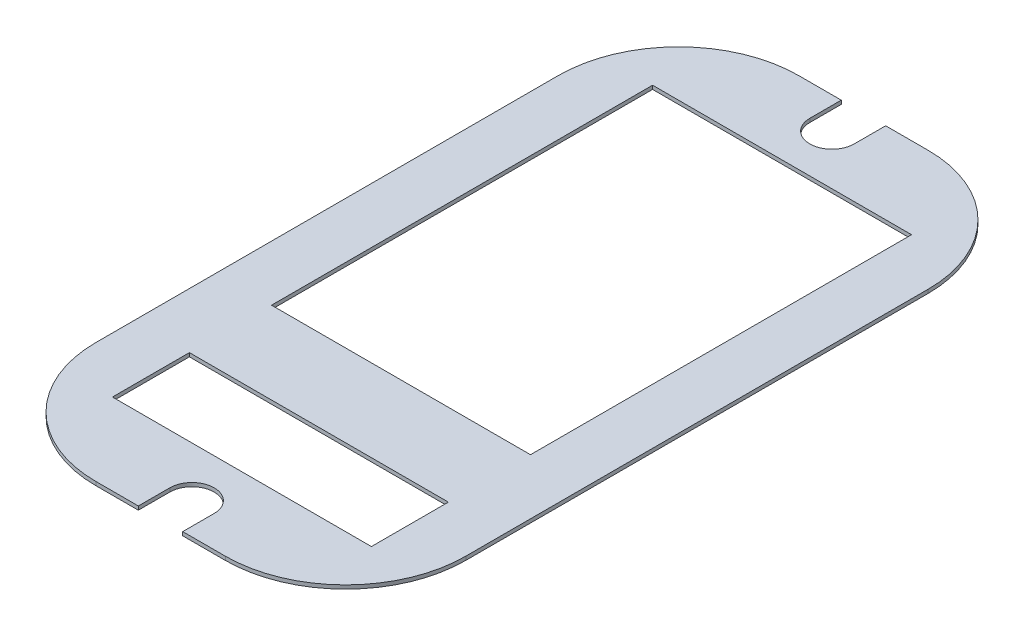
from build123d import *

# Parameters (mm, degrees)
SKETCH2_W           = 7
SKETCH2_H           = 10.3
SKETCH2_H_2         = 2.08
BOSS_EXTRUDE1_DEPTH = 0.1


with BuildPart() as part:
    # Sketch2 → Boss-Extrude1 (new body)
    with BuildSketch(Plane(origin=(0, 0, 0), x_dir=(1, 0, 0), z_dir=(0, 1, 0))):
        with BuildLine():
            Line((-0.6, 9.5), (-1.75, 9.5))
            ThreePointArc((-1.75, 9.5), (-4.048097039, 8.548097039), (-5, 6.25))
            Line((-5, 6.25), (-5, -6.25))
            ThreePointArc((-5, -6.25), (-4.048097039, -8.548097039), (-1.75, -9.5))
            Line((-1.75, -9.5), (-0.6, -9.5))
            Line((-0.6, -9.5), (-0.6, -8.65))
            ThreePointArc((-0.6, -8.65), (0, -8.05), (0.6, -8.65))
            Line((0.6, -8.65), (0.6, -9.5))
            Line((0.6, -9.5), (1.75, -9.5))
            ThreePointArc((1.75, -9.5), (4.048097039, -8.548097039), (5, -6.25))
            Line((5, -6.25), (5, 6.25))
            ThreePointArc((5, 6.25), (4.048097039, 8.548097039), (1.75, 9.5))
            Line((1.75, 9.5), (0.6, 9.5))
            Line((0.6, 9.5), (0.6, 8.65))
            ThreePointArc((0.6, 8.65), (0, 8.05), (-0.6, 8.65))
            Line((-0.6, 8.65), (-0.6, 9.5))
        make_face()
        with Locations((0, 2.15)):
            Rectangle(SKETCH2_W, SKETCH2_H, mode=Mode.SUBTRACT)
        with Locations((0, -6.26)):
            Rectangle(SKETCH2_W, SKETCH2_H_2, mode=Mode.SUBTRACT)
    extrude(amount=BOSS_EXTRUDE1_DEPTH)


solid = part.part
